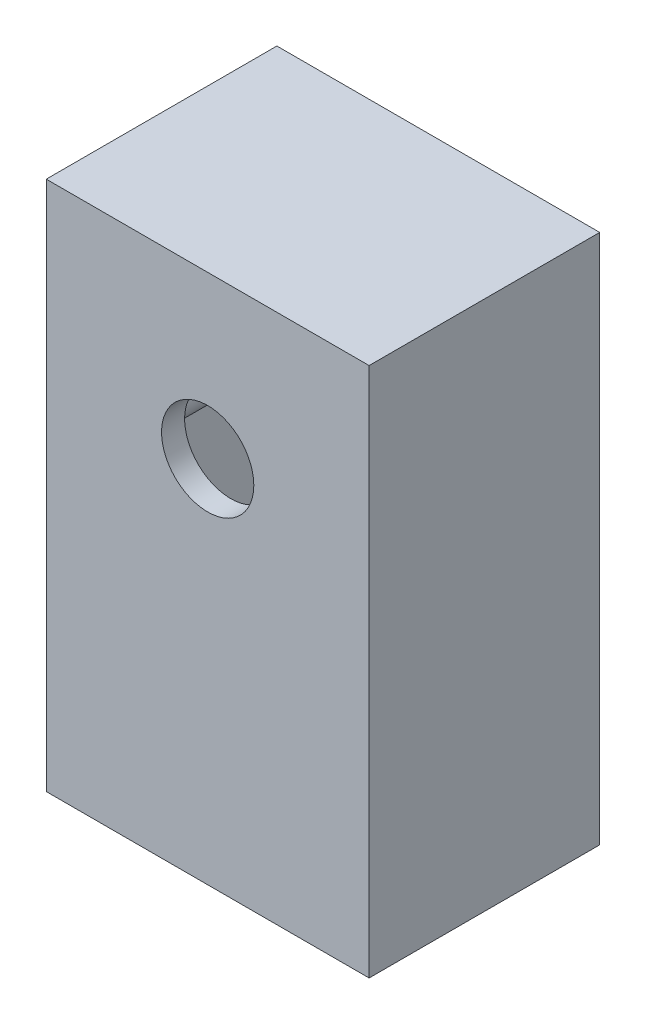
from build123d import *

# Parameters (mm, degrees)
CROQUIS1_W                   = 14000
CROQUIS1_H                   = 23000
CROQUIS1_R                   = 2000
SALIENTE_EXTRUIR1_DEPTH      = 1000
SALIENTE_EXTRUIR2_DEPTH      = 10000
SALIENTE_EXTRUIR3_DEPTH      = 500
SALIENTE_EXTRUIR3_DEPTH_BACK = 500


with BuildPart() as part:
    # Croquis1 → Saliente-Extruir1 (new body)
    with BuildSketch(Plane.XY):
        with Locations((124743.416897498, 163837.836627923)):
            Rectangle(CROQUIS1_W, CROQUIS1_H)
        with Locations((124743.416897498, 168337.836627923)):
            Circle(CROQUIS1_R, mode=Mode.SUBTRACT)
    extrude(amount=-SALIENTE_EXTRUIR1_DEPTH)

    # Croquis1<6> → Saliente-Extruir2 (add)
    with BuildSketch(Plane.XY):
        with BuildLine():
            Line((117743.416897498, 152337.836627923), (118743.416897498, 152337.836627923))
            Line((118743.416897498, 152337.836627923), (118743.416897498, 166437.836627923))
            Line((118743.416897498, 166437.836627923), (120243.416897498, 166437.836627923))
            ThreePointArc((120243.416897498, 166437.836627923), (121233.366391159, 166847.887134262), (121643.416897498, 167837.836627923))
            Line((121643.416897498, 167837.836627923), (121643.416897498, 168837.836627923))
            ThreePointArc((121643.416897498, 168837.836627923), (121233.366391159, 169827.786121585), (120243.416897498, 170237.836627923))
            Line((120243.416897498, 170237.836627923), (118743.416897498, 170237.836627923))
            Line((118743.416897498, 170237.836627923), (118743.416897498, 174337.836627923))
            Line((118743.416897498, 174337.836627923), (122843.416897498, 174337.836627923))
            Line((122843.416897498, 174337.836627923), (122843.416897498, 172837.836627923))
            ThreePointArc((122843.416897498, 172837.836627923), (123253.467403837, 171847.887134262), (124243.416897498, 171437.836627923))
            Line((124243.416897498, 171437.836627923), (125243.416897498, 171437.836627923))
            ThreePointArc((125243.416897498, 171437.836627923), (126233.366391159, 171847.887134262), (126643.416897498, 172837.836627923))
            Line((126643.416897498, 172837.836627923), (126643.416897498, 174337.836627923))
            Line((126643.416897498, 174337.836627923), (130743.416897498, 174337.836627923))
            Line((130743.416897498, 174337.836627923), (130743.416897498, 170237.836627923))
            Line((130743.416897498, 170237.836627923), (129243.416897498, 170237.836627923))
            ThreePointArc((129243.416897498, 170237.836627923), (128253.467403837, 169827.786121585), (127843.416897498, 168837.836627923))
            Line((127843.416897498, 168837.836627923), (127843.416897498, 167837.836627923))
            ThreePointArc((127843.416897498, 167837.836627923), (128253.467403837, 166847.887134262), (129243.416897498, 166437.836627923))
            Line((129243.416897498, 166437.836627923), (130743.416897498, 166437.836627923))
            Line((130743.416897498, 166437.836627923), (130743.416897498, 152337.836627923))
            Line((130743.416897498, 152337.836627923), (131743.416897498, 152337.836627923))
            Line((131743.416897498, 152337.836627923), (131743.416897498, 175337.836627923))
            Line((131743.416897498, 175337.836627923), (117743.416897498, 175337.836627923))
            Line((117743.416897498, 175337.836627923), (117743.416897498, 152337.836627923))
        make_face()
    extrude(amount=-SALIENTE_EXTRUIR2_DEPTH)

    # Croquis2 → Saliente-Extruir3 (add, two sides: drawn at the far end of the back side and taken through both)
    with BuildSketch(Plane(origin=(0, 156837.836627923, 0), x_dir=(1, 0, 0), z_dir=(0, 1, 0)).offset(-SALIENTE_EXTRUIR3_DEPTH_BACK)):
        with BuildLine():
            add(Edge.make_bspline(
                [(118743.416897498, 8000), (120739.811138244, 7120.578794783), (120743.416897498, 1000)],
                knots=[0, 0, 0, 0.514460755, 0.514460755, 0.514460755], degree=2))
            Line((118743.416897498, 8000), (118743.416897498, 1000))
            Line((118743.416897498, 1000), (120743.416897498, 1000))
        make_face()
        with BuildLine():
            Line((130743.416897498, 1000), (130743.416897498, 8000))
            add(Edge.make_bspline(
                [(130743.416897498, 8000), (128761.675222051, 7234.348262256), (128743.416897498, 1000)],
                knots=[0, 0, 0, 0.590989184, 0.590989184, 0.590989184], degree=2))
            Line((128743.416897498, 1000), (130743.416897498, 1000))
        make_face()
    extrude(amount=SALIENTE_EXTRUIR3_DEPTH + SALIENTE_EXTRUIR3_DEPTH_BACK)


solid = part.part
